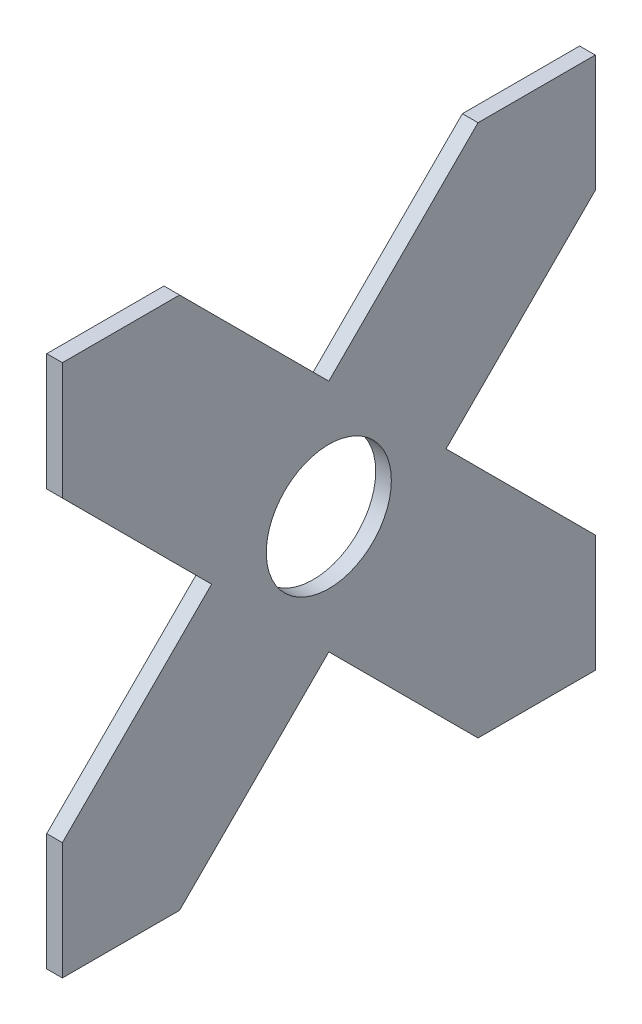
from build123d import *

# Parameters (mm, degrees)
BOSS_EXTRUDE2_DEPTH = 10
SKETCH3_R           = 40
CUT_EXTRUDE1_DEPTH  = 10


with BuildPart() as part:
    # Sketch1 → Boss-Extrude2 (new body)
    with BuildSketch(Plane(origin=(0, 0, 0), x_dir=(0, 0, -1), z_dir=(1, 0, 0))):
        Polygon((0, 0), (75, 0), (170.45941546, 95.45941546), (265.91883092, 0), (340.91883092, 0), (340.91883092, 75), (245.45941546, 170.45941546), (340.91883092, 265.91883092), (340.91883092, 340.91883092), (265.91883092, 340.91883092), (170.45941546, 245.45941546), (75, 340.91883092), (0, 340.91883092), (0, 265.91883092), (95.45941546, 170.45941546), (0, 75), align=None)
    extrude(amount=BOSS_EXTRUDE2_DEPTH)

    # Sketch3 → Cut-Extrude1 (cut)
    with BuildSketch(Plane(origin=(10, 0, 0), x_dir=(0, 0, -1), z_dir=(1, 0, 0))):
        with Locations((170.45941546, 170.45941546)):
            Circle(SKETCH3_R)
    extrude(amount=-CUT_EXTRUDE1_DEPTH, mode=Mode.SUBTRACT)


solid = part.part
